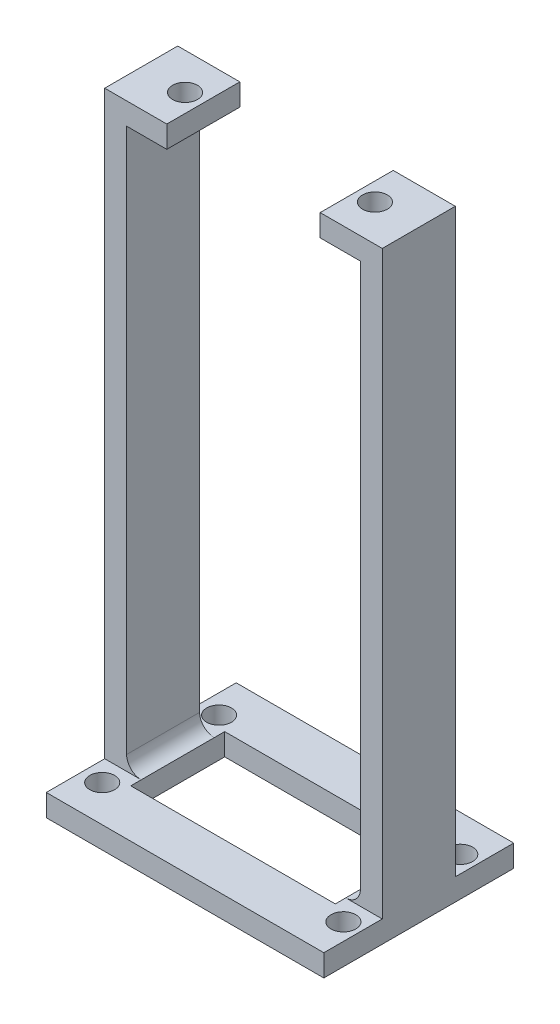
from build123d import *

# Parameters (mm, degrees)
BOSS_EXTRUDE1_DEPTH      = 5
BOSS_EXTRUDE1_DEPTH_BACK = 5
SKETCH3_W                = 38
SKETCH3_H                = 26
BOSS_EXTRUDE2_DEPTH      = 3
M3_CLEARANCE_HOLE1_D     = 3.4
M3_CLEARANCE_HOLE1_DEPTH = 3
FILLET3_R                = 2
M3_CLEARANCE_HOLE2_D     = 3.4
M3_CLEARANCE_HOLE2_DEPTH = 10
M3_CLEARANCE_HOLE2_TIP   = 1.021463052
SKETCH4_W                = 28
SKETCH4_H                = 12.861112754
CUT_EXTRUDE2_DEPTH       = 3


with BuildPart() as part:
    # Sketch1 → Boss-Extrude1 (new, two sides: drawn at the far end of the back side and taken through both)
    with BuildSketch(Plane.XY.offset(-BOSS_EXTRUDE1_DEPTH_BACK)):
        Polygon((19, -3), (-19, -3), (-19, 44.583333333), (-19, 79.5), (-10.5, 79.5), (-10.5, 76.5), (-16, 76.5), (-16, 0), (16, 0), (16, 76.5), (10.5, 76.5), (10.5, 79.5), (19, 79.5), align=None)
    extrude(amount=BOSS_EXTRUDE1_DEPTH + BOSS_EXTRUDE1_DEPTH_BACK)

    # Sketch3 → Boss-Extrude2 (add)
    with BuildSketch(Plane(origin=(0, -3, 0), x_dir=(-1, 0, 0), z_dir=(0, -1, 0))):
        Rectangle(SKETCH3_W, SKETCH3_H)
    extrude(amount=-BOSS_EXTRUDE2_DEPTH)

    # M3 Clearance Hole1
    with Locations(Plane(origin=(0, 79.5, 0), x_dir=(1, 0, 0), z_dir=(0, 1, 0))):
        with Locations((-13, 0), (13, 0)):
            Hole(M3_CLEARANCE_HOLE1_D / 2, depth=M3_CLEARANCE_HOLE1_DEPTH)

    # Fillet3
    fillet3_edges = [part.edges().sort_by_distance(p)[0] for p in [
        (-16, 0, 0),
        (16, 0, 0),
    ]]
    fillet(fillet3_edges, radius=FILLET3_R)

    # M3 Clearance Hole2
    with Locations(Plane(origin=(0, 0, 0), x_dir=(1, 0, 0), z_dir=(0, 1, 0))):
        with Locations((16.679968376, -8), (-16.340858472, -8), (16.679968376, 8), (-16.340858472, 8)):
            Hole(M3_CLEARANCE_HOLE2_D / 2, depth=M3_CLEARANCE_HOLE2_DEPTH)
            with Locations((0, 0, -(M3_CLEARANCE_HOLE2_DEPTH + M3_CLEARANCE_HOLE2_TIP / 2))):  # 118° drill point
                Cone(0, M3_CLEARANCE_HOLE2_D / 2, M3_CLEARANCE_HOLE2_TIP, mode=Mode.SUBTRACT)

    # Sketch4 → Cut-Extrude2 (cut)
    with BuildSketch(Plane.XZ.offset(3)):
        Rectangle(SKETCH4_W, SKETCH4_H)
    extrude(amount=-CUT_EXTRUDE2_DEPTH, mode=Mode.SUBTRACT)


solid = part.part
